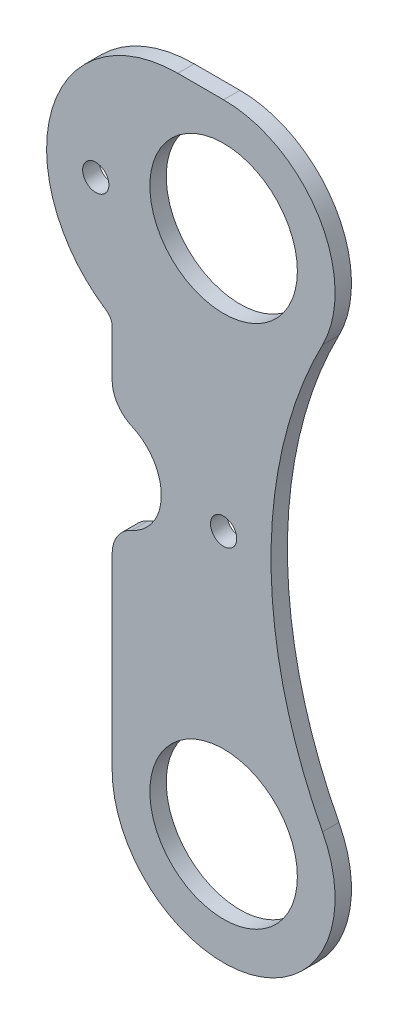
from build123d import *

# Parameters (mm, degrees)
SKETCH1_R           = 14.2875
SKETCH1_R_2         = 2.54
BOSS_EXTRUDE1_DEPTH = 3.175
CUT_EXTRUDE1_DEPTH  = 162.674043733
FILLET3_R           = 6.35
SKETCH3_R           = 2.54
BOSS_EXTRUDE3_DEPTH = 3.175
SKETCH6_R           = 2.54
BOSS_EXTRUDE4_DEPTH = 3.175
FILLET2_R           = 6.35
CUT_EXTRUDE2_DEPTH  = 169.237022961
CUT_EXTRUDE3_DEPTH  = 169.237022961
CUT_EXTRUDE4_DEPTH  = 168.265702461
SKETCH15_R          = 2.54
BOSS_EXTRUDE8_DEPTH = 3.175
FILLET4_R           = 2.54


with BuildPart() as part:
    # Sketch1 → Boss-Extrude1 (new body)
    with BuildSketch(Plane.XY):
        with BuildLine():
            Line((-8.89, 25.4), (8.89, 25.4))
            ThreePointArc((8.89, 25.4), (17.870256121, 21.680256121), (21.59, 12.7))
            Line((21.59, 12.7), (21.59, -117.775079775))
            ThreePointArc((21.59, -117.775079775), (21.127743647, -120.388718212), (19.797058824, -122.685251408))
            Line((19.797058824, -122.685251408), (-7.952696208, -155.616779465))
            ThreePointArc((-7.952696208, -155.616779465), (-12.268297602, -157.851943494), (-16.900388255, -156.380852124))
            Line((-16.900388255, -156.380852124), (-32.439211784, -143.287061102))
            ThreePointArc((-32.439211784, -143.287061102), (-34.674375812, -138.971459708), (-33.203284443, -134.339369055))
            Line((-33.203284443, -134.339369055), (-23.382941176, -122.685251408))
            ThreePointArc((-23.382941176, -122.685251408), (-22.052256353, -120.388718212), (-21.59, -117.775079775))
            Line((-21.59, -117.775079775), (-21.59, 12.7))
            ThreePointArc((-21.59, 12.7), (-17.870256121, 21.680256121), (-8.89, 25.4))
        make_face()
        Circle(SKETCH1_R, mode=Mode.SUBTRACT)
        with Locations((0, -101.6)):
            Circle(SKETCH1_R, mode=Mode.SUBTRACT)
        with Locations((-18.532085478, -142.550133084)):
            Circle(SKETCH1_R_2, mode=Mode.SUBTRACT)
        with Locations((0, -50.8)):
            Circle(SKETCH1_R_2, mode=Mode.SUBTRACT)
    extrude(amount=BOSS_EXTRUDE1_DEPTH)

    # Sketch2 → Cut-Extrude1 (cut, through all)
    with BuildSketch(Plane.XY):
        with BuildLine():
            ThreePointArc((19.159083004, -91.647229609), (9.182340769, -50.8), (19.159083004, -9.952770391))
            ThreePointArc((19.159083004, -9.952770391), (20.973467787, -5.122670102), (21.59, 0))
            Line((21.59, 0), (27.94, 0))
            Line((27.94, 0), (27.94, -121.656687185))
            Line((27.94, -121.656687185), (-7.620284479, -163.8572221))
            Line((-7.620284479, -163.8572221), (-17.501317584, -155.874478972))
            Line((-17.501317584, -155.874478972), (16.51, -115.512152961))
            ThreePointArc((16.51, -115.512152961), (20.280273667, -109.005308906), (21.59, -101.6))
            ThreePointArc((21.59, -101.6), (20.973467787, -96.477329898), (19.159083004, -91.647229609))
        make_face()
        with BuildLine():
            Line((-21.59, -41.275), (-21.59, -60.325))
            ThreePointArc((-21.59, -60.325), (-12.065, -50.8), (-21.59, -41.275))
        make_face()
    extrude(amount=CUT_EXTRUDE1_DEPTH, mode=Mode.SUBTRACT)


with BuildPart() as cut_extrude1_piece_1:
    # of the separate pieces the step leaves, piece 1, a body of its own (cut_extrude1_pieces)
    add(part.part.solids().sort_by_distance((-8.89, 25.4, 0))[0])

    # Fillet3
    fillet3_edges = [cut_extrude1_piece_1.edges().sort_by_distance(p)[0] for p in [
        (-21.59, -41.275, 1.5875),
        (-21.59, -60.325, 1.5875),
    ]]
    fillet(fillet3_edges, radius=FILLET3_R)

    # Sketch3 → Boss-Extrude3 (add)
    with BuildSketch(Plane.XY.offset(3.175)):
        with BuildLine():
            Line((-27.351416194, -127.394768527), (-36.025496499, -137.688579))
            ThreePointArc((-36.025496499, -137.688579), (-37.217489152, -141.441859142), (-35.4063854, -144.93869507))
            Line((-35.4063854, -144.93869507), (-24.403104784, -154.210610454))
            ThreePointArc((-24.403104784, -154.210610454), (-19.771014132, -155.681701823), (-15.455412737, -153.446537795))
            Line((-15.455412737, -153.446537795), (-7.557639641, -144.073996091))
            Line((-7.557639641, -144.073996091), (-27.351416194, -127.394768527))
        make_face()
        with Locations((-18.532085478, -142.550133084)):
            Circle(SKETCH3_R, mode=Mode.SUBTRACT)
    extrude(amount=-BOSS_EXTRUDE3_DEPTH)

    # Sketch6 → Boss-Extrude4 (add)
    with BuildSketch(Plane.XY.offset(3.175)):
        Polygon((-35.4063854, -144.93869507), (-63.620410749, -121.164144113), (-51.344981666, -106.596497054), (-27.065569901, -127.055545526), align=None)
        with Locations((-52.626813855, -117.972130278)):
            Circle(SKETCH6_R, mode=Mode.SUBTRACT)
    extrude(amount=-BOSS_EXTRUDE4_DEPTH)

    # Fillet2
    fillet2_edges = [cut_extrude1_piece_1.edges().sort_by_distance(p)[0] for p in [
        (-63.620410749, -121.164144113, 1.5875),
        (-51.344981666, -106.596497054, 1.5875),
        (-27.065569901, -127.055545526, 1.5875),
    ]]
    fillet(fillet2_edges, radius=FILLET2_R)

    # Sketch7 → Cut-Extrude2 (cut, through all)
    with BuildSketch(Plane.XY.offset(3.175)):
        with BuildLine():
            Line((-21.59, 0), (-21.59, 31.75))
            Line((-21.59, 31.75), (21.59, 31.75))
            Line((21.59, 31.75), (21.59, 0))
            ThreePointArc((21.59, 0), (0, 21.59), (-21.59, 0))
        make_face()
    extrude(amount=-CUT_EXTRUDE2_DEPTH, mode=Mode.SUBTRACT)


with BuildPart() as cut_extrude1_piece_2:
    # of the separate pieces the step leaves, piece 2, a body of its own (cut_extrude1_pieces)
    add(part.part.solids().sort_by_distance((-16.900388255, -156.380852124, 0))[0])


with BuildPart() as cut_extrude3_tool:
    # Sketch10 → Cut-Extrude3 (new, through all)
    with BuildSketch(Plane.XY.offset(3.175)):
        with BuildLine():
            Line((-18.151882461, -155.32628042), (-17.361482582, -157.512020269))
            Line((-17.361482582, -157.512020269), (-14.375706423, -156.432313955))
            Line((-14.375706423, -156.432313955), (-15.455412737, -153.446537795))
            ThreePointArc((-15.455412737, -153.446537795), (-16.679911193, -154.563907595), (-18.151882461, -155.32628042))
        make_face()
    extrude(amount=-CUT_EXTRUDE3_DEPTH)


with BuildPart() as cut_extrude1_piece_1_1:
    add(cut_extrude1_piece_1.part)

    # Cut-Extrude3: cut by cut_extrude3_tool
    add(cut_extrude3_tool.part, mode=Mode.SUBTRACT)

    # Sketch12 → Cut-Extrude4 (cut, through all)
    with BuildSketch(Plane.XY.offset(3.175)):
        with BuildLine():
            Line((-21.59, -101.6), (-72.39, -101.6))
            Line((-72.39, -101.6), (-72.39, -165.1))
            Line((-72.39, -165.1), (16.51, -165.1))
            Line((16.51, -165.1), (16.51, -115.512152961))
            ThreePointArc((16.51, -115.512152961), (-7.405308906, -121.880273667), (-21.59, -101.6))
        make_face()
    extrude(amount=-CUT_EXTRUDE4_DEPTH, mode=Mode.SUBTRACT)

    # Sketch15 → Boss-Extrude8 (add)
    with BuildSketch(Plane.XY.offset(3.175)):
        with BuildLine():
            ThreePointArc((-34.29, -3.81), (-30.887045256, -16.51), (-21.59, -25.807045256))
            Line((-21.59, -25.807045256), (-21.59, 0))
            ThreePointArc((-21.59, 0), (-15.266435406, 15.266435406), (0, 21.59))
            Line((0, 21.59), (-8.89, 21.59))
            ThreePointArc((-8.89, 21.59), (-26.850512242, 14.150512242), (-34.29, -3.81))
        make_face()
        with Locations((-24.765, -3.81)):
            Circle(SKETCH15_R, mode=Mode.SUBTRACT)
    extrude(amount=-BOSS_EXTRUDE8_DEPTH)

    # Fillet4
    fillet4_edges = [cut_extrude1_piece_1_1.edges().sort_by_distance(p)[0] for p in [
        (-21.59, -25.807045256, 1.5875),
    ]]
    fillet(fillet4_edges, radius=FILLET4_R)


with BuildPart() as cut_extrude1_piece_2_1:
    add(cut_extrude1_piece_2.part)

    # Cut-Extrude3: cut by cut_extrude3_tool
    add(cut_extrude3_tool.part, mode=Mode.SUBTRACT)


solid = cut_extrude1_piece_1_1.part
